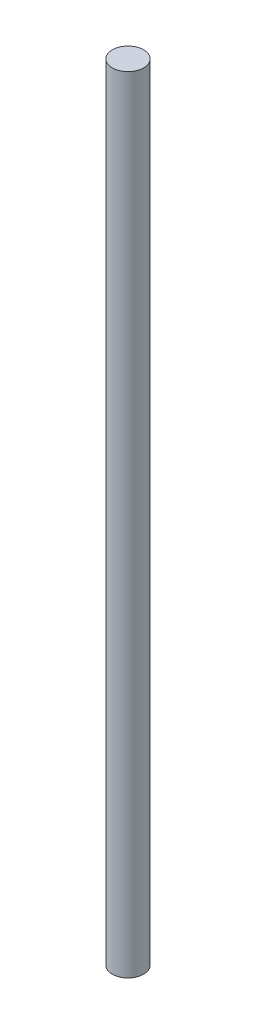
from build123d import *

# Parameters (mm, degrees)
SKETCH_2_R      = 2
EXTRUDE_2_DEPTH = 100


with BuildPart() as part:
    # 草图2 → 凸台-拉伸2 (new body)
    with BuildSketch(Plane(origin=(0, 0, 0), x_dir=(1, 0, 0), z_dir=(0, 1, 0))):
        with Locations(Location((0, 0, 0), (0, 0, 270))):
            Circle(SKETCH_2_R)
    extrude(amount=EXTRUDE_2_DEPTH)


solid = part.part
